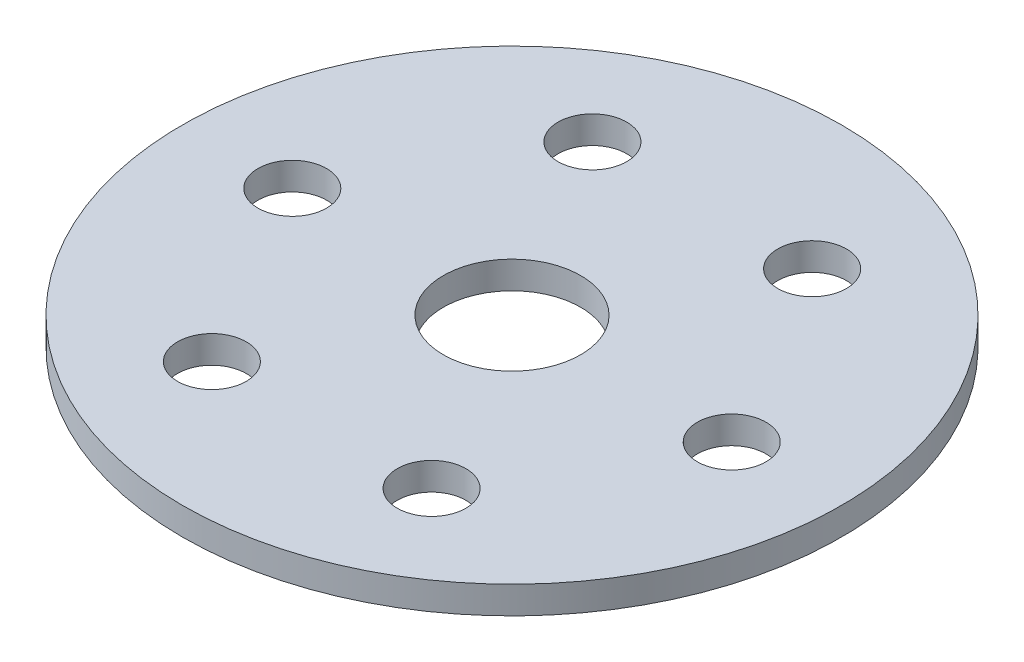
from build123d import *

# Parameters (mm, degrees)
SKETCH1_R                    = 76.2
SKETCH1_R_2                  = 15.875
PLATE_EXTRUDE_DEPTH          = 6.35
F_5_8_0_625_DIAMETER_HOLE1_D = 15.875
CIRPATTERN1_COUNT            = 6


with BuildPart() as part:
    # Sketch1 → Plate extrude (new body)
    with BuildSketch(Plane(origin=(0, 0, 0), x_dir=(1, 0, 0), z_dir=(0, 1, 0))):
        with Locations(Location((0, 0, 0), (0, 0, 270))):
            Circle(SKETCH1_R)
        with Locations(Location((0, 0, 0), (0, 0, 270))):
            Circle(SKETCH1_R_2, mode=Mode.SUBTRACT)
    extrude(amount=PLATE_EXTRUDE_DEPTH)

    # 5/8 (0.625) Diameter Hole1 (through all)
    with Locations(Plane(origin=(0, 6.35, 0), x_dir=(1, 0, 0), z_dir=(0, 1, 0))):
        with Locations((-50.8, 0)):
            f_5_8_0_625_diameter_hole1 = Hole(F_5_8_0_625_DIAMETER_HOLE1_D / 2)

    # CirPattern1: 5/8 (0.625) Diameter Hole1 ×6 about axis
    cirpattern1_axis = Axis((0, 0, 0), (0, 1, 0))
    for i in range(1, CIRPATTERN1_COUNT):
        add(f_5_8_0_625_diameter_hole1.rotate(cirpattern1_axis, i * 360 / CIRPATTERN1_COUNT), mode=Mode.SUBTRACT)


solid = part.part
